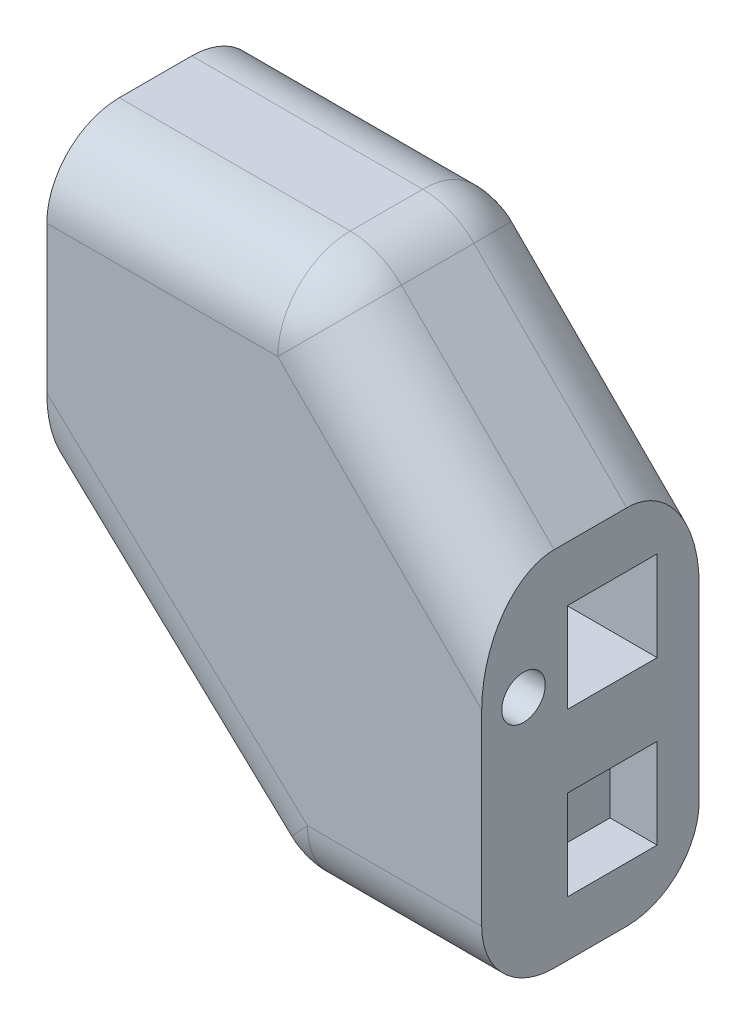
from build123d import *

# Parameters (mm, degrees)
BOSS_EXTRUDE1_DEPTH = 15
FILLET1_R           = 5
SKETCH4_W           = 6.2
SKETCH4_H           = 6.2
CUT_EXTRUDE1_DEPTH  = 3.25
SKETCH5_W           = 6.2
SKETCH5_H           = 6.2
CUT_EXTRUDE2_DEPTH  = 3.25
SKETCH8_W           = 6.2
SKETCH8_H           = 6.2
CUT_EXTRUDE3_DEPTH  = 10
SKETCH9_W           = 6.2
SKETCH9_H           = 6.158762439
CUT_EXTRUDE4_DEPTH  = 8
SKETCH10_W          = 6.2
SKETCH10_H          = 6.244686175
CUT_EXTRUDE6_DEPTH  = 20
SKETCH11_R          = 1.5
CUT_EXTRUDE7_DEPTH  = 36


with BuildPart() as part:
    # Sketch2 → Boss-Extrude1 (new body)
    with BuildSketch(Plane.XY):
        Polygon((29.5, -24.5), (29.5, 0.5), (17.5, 12.5), (-0.5, 12.5), (-0.5, -9.5), (15.5, -24.5), align=None)
    extrude(amount=BOSS_EXTRUDE1_DEPTH)

    # Fillet1
    fillet1_edges = [part.edges().sort_by_distance(p)[0] for p in [
        (15.5, -24.5, 7.5),
        (17.5, 12.5, 7.5),
        (23.5, 6.5, 15),
        (8.5, 12.5, 15),
        (7.5, -17, 15),
        (22.5, -24.5, 15),
        (7.5, -17, 0),
        (8.5, 12.5, 0),
        (23.5, 6.5, 0),
        (22.5, -24.5, 0),
    ]]
    fillet(fillet1_edges, radius=FILLET1_R)

    # Sketch4 → Cut-Extrude1 (cut)
    with BuildSketch(Plane(origin=(29.5, 0, 0), x_dir=(0, 0, -1), z_dir=(1, 0, 0))):
        with Locations((-6, -17.6)):
            Rectangle(SKETCH4_W, SKETCH4_H)
        with Locations((-6, -6.4)):
            Rectangle(SKETCH4_W, SKETCH4_H)
    extrude(amount=-CUT_EXTRUDE1_DEPTH, mode=Mode.SUBTRACT)

    # Sketch5 → Cut-Extrude2 (cut)
    with BuildSketch(Plane.ZY.offset(0.5)):
        with Locations((7.5, 1.5)):
            Rectangle(SKETCH5_W, SKETCH5_H)
    extrude(amount=-CUT_EXTRUDE2_DEPTH, mode=Mode.SUBTRACT)

    # Sketch8 → Cut-Extrude3 (cut)
    with BuildSketch(Plane.ZY.offset(-2.75)):
        with Locations((7.5, 1.5)):
            Rectangle(SKETCH8_W, SKETCH8_H)
    extrude(amount=-CUT_EXTRUDE3_DEPTH, mode=Mode.SUBTRACT)

    # Sketch9 → Cut-Extrude4 (cut)
    with BuildSketch(Plane(origin=(0, -1.6, 0), x_dir=(1, 0, 0), z_dir=(0, 1, 0))):
        with Locations((9.626788027, -7.520618781)):
            Rectangle(SKETCH9_W, SKETCH9_H)
    extrude(amount=-CUT_EXTRUDE4_DEPTH, mode=Mode.SUBTRACT)

    # Sketch10 → Cut-Extrude6 (cut)
    with BuildSketch(Plane(origin=(26.25, 0, 0), x_dir=(0, 0, -1), z_dir=(1, 0, 0))):
        with Locations((-6, -6.377656912)):
            Rectangle(SKETCH10_W, SKETCH10_H)
    extrude(amount=-CUT_EXTRUDE6_DEPTH, mode=Mode.SUBTRACT)

    # Sketch11 → Cut-Extrude7 (cut)
    with BuildSketch(Plane(origin=(29.5, 0, 0), x_dir=(0, 0, -1), z_dir=(1, 0, 0))):
        with Locations((-12.118468993, -7.263784025)):
            Circle(SKETCH11_R)
    extrude(amount=-CUT_EXTRUDE7_DEPTH, mode=Mode.SUBTRACT)


solid = part.part
